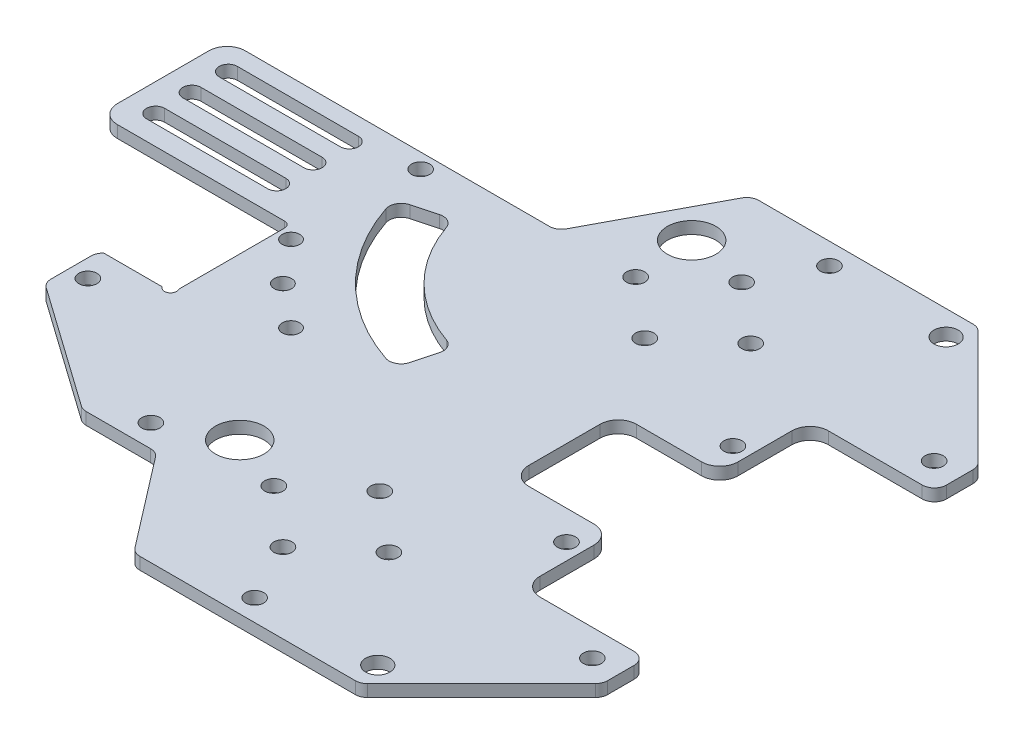
from build123d import *

# Parameters (mm, degrees)
SKETCH1_R           = 1.5
SKETCH1_R_2         = 2
SKETCH1_R_3         = 1.45
BOSS_EXTRUDE1_DEPTH = 2
CUT_EXTRUDE1_DEPTH  = 2
FILLET1_R           = 3
SKETCH3_R           = 1.5
CUT_EXTRUDE2_DEPTH  = 10
SKETCH_1_W          = 11.141106223
SKETCH_1_H          = 2.064068387
CUT_EXTRUDE_1_DEPTH = 10
SKETCH_2_R          = 4
CUT_EXTRUDE_2_DEPTH = 96.448488805
FILLET2_R           = 2
SKETCH4_R           = 1
CUT_EXTRUDE3_DEPTH  = 10
SKETCH5_W           = 11.82747082
SKETCH5_H           = 19.50302412
CUT_EXTRUDE4_DEPTH  = 10
FILLET3_R           = 1


with BuildPart() as part:
    # Sketch1 → Boss-Extrude1 (new body)
    with BuildSketch(Plane(origin=(0, 0, 0), x_dir=(1, 0, 0), z_dir=(0, 1, 0))):
        with BuildLine():
            Line((54.869224403, -12.305407816), (44.089868135, -12.305407816))
            ThreePointArc((44.089868135, -12.305407816), (41.968547791, -11.42672816), (41.089868135, -9.305407816))
            Line((41.089868135, -9.305407816), (41.089868135, 2.471948803))
            ThreePointArc((41.089868135, 2.471948803), (41.968547791, 4.593269147), (44.089868135, 5.471948803))
            Line((44.089868135, 5.471948803), (54.869224403, 5.471948803))
            ThreePointArc((54.869224403, 5.471948803), (56.990544747, 6.35062846), (57.869224403, 8.471948803))
            Line((57.869224403, 8.471948803), (57.869224403, 17.375765412))
            ThreePointArc((57.869224403, 17.375765412), (58.74790406, 19.497085755), (60.869224403, 20.375765412))
            Line((60.869224403, 20.375765412), (78.389804663, 20.375765412))
            Line((78.389804663, 20.375765412), (78.389804663, 27.585770494))
            Line((78.389804663, 27.585770494), (58.389804663, 47.585770494))
            Line((58.389804663, 47.585770494), (20.979804663, 47.585770494))
            Line((20.979804663, 47.585770494), (9.812981375, 26.583270494))
            Line((9.812981375, 26.583270494), (-13.868656246, 26.583270494))
            Line((-13.868656246, 26.583270494), (-44.620364758, 26.583270494))
            Line((-44.620364758, 26.583270494), (-44.620364758, 5.471948803))
            Line((-44.620364758, 5.471948803), (-13.868656246, 5.471948803))
            Line((-13.868656246, 5.471948803), (-13.868656246, -11.444658054))
            Line((-13.868656246, -11.444658054), (-25.009762469, -11.444658054))
            Line((-25.009762469, -11.444658054), (-25.009762469, -23.143538054))
            Line((-25.009762469, -23.143538054), (-3.796559034, -38.143538054))
            Line((-3.796559034, -38.143538054), (8.464513563, -38.143538054))
            Line((8.464513563, -38.143538054), (20.979804663, -54.419229506))
            Line((20.979804663, -54.419229506), (58.389804663, -54.419229506))
            Line((58.389804663, -54.419229506), (78.389804663, -34.419229506))
            Line((78.389804663, -34.419229506), (78.389804663, -27.209224425))
            Line((78.389804663, -27.209224425), (60.869224403, -27.209224425))
            ThreePointArc((60.869224403, -27.209224425), (58.74790406, -26.330544768), (57.869224403, -24.209224425))
            Line((57.869224403, -24.209224425), (57.869224403, -15.305407816))
            ThreePointArc((57.869224403, -15.305407816), (56.990544747, -13.184087473), (54.869224403, -12.305407816))
        make_face()
        with Locations(Location((32.479804663, -41.294229506, 0), (0, 0, 270))):
            Circle(SKETCH1_R, mode=Mode.SUBTRACT)
        with Locations(Location((41.979804663, -33.294229506, 0), (0, 0, 270))):
            Circle(SKETCH1_R, mode=Mode.SUBTRACT)
        with Locations(Location((32.479804663, -25.294229506, 0), (0, 0, 270))):
            Circle(SKETCH1_R, mode=Mode.SUBTRACT)
        with Locations(Location((22.979804663, -33.294229506, 0), (0, 0, 270))):
            Circle(SKETCH1_R, mode=Mode.SUBTRACT)
        with Locations(Location((-10.194098263, 24.120202053, 0), (0, 0, 270))):
            Circle(SKETCH1_R, mode=Mode.SUBTRACT)
        with Locations(Location((-22.049699545, -18.984613762, 0), (0, 0, 270))):
            Circle(SKETCH1_R, mode=Mode.SUBTRACT)
        with Locations(Location((3.798471154, -34.419229506, 0), (0, 0, 270))):
            Circle(SKETCH1_R, mode=Mode.SUBTRACT)
        with Locations(Location((57.193929966, -50.345885936, 0), (0, 0, 270))):
            Circle(SKETCH1_R_2, mode=Mode.SUBTRACT)
        with Locations(Location((55.174344354, -17.159547773, 0), (0, 0, 270))):
            Circle(SKETCH1_R, mode=Mode.SUBTRACT)
        with Locations(Location((55.174344354, 10.32608876, 0), (0, 0, 270))):
            Circle(SKETCH1_R, mode=Mode.SUBTRACT)
        with Locations(Location((-10.866471131, 3.389008325, 0), (0, 0, 270))):
            Circle(SKETCH1_R_3, mode=Mode.SUBTRACT)
        with Locations(Location((-5.208623843, -3.610189063, 0), (0, 0, 270))):
            Circle(SKETCH1_R_3, mode=Mode.SUBTRACT)
        with Locations(Location((1.790573544, -9.268036351, 0), (0, 0, 270))):
            Circle(SKETCH1_R_3, mode=Mode.SUBTRACT)
        with Locations(Location((57.193929966, 43.512426923, 0), (0, 0, 90))):
            Circle(SKETCH1_R_2, mode=Mode.SUBTRACT)
        with Locations(Location((22.979804663, 26.460770494, 0), (0, 0, 90))):
            Circle(SKETCH1_R, mode=Mode.SUBTRACT)
        with Locations(Location((32.479804663, 18.460770494, 0), (0, 0, 90))):
            Circle(SKETCH1_R, mode=Mode.SUBTRACT)
        with Locations(Location((41.979804663, 26.460770494, 0), (0, 0, 90))):
            Circle(SKETCH1_R, mode=Mode.SUBTRACT)
        with Locations(Location((32.479804663, 34.460770494, 0), (0, 0, 90))):
            Circle(SKETCH1_R, mode=Mode.SUBTRACT)
        with BuildLine():
            Line((16.558909908, -4.425834893), (17.596504785, -0.553478093))
            ThreePointArc((17.596504785, -0.553478093), (17.431334664, 0.901622726), (16.318958433, 1.854103006))
            ThreePointArc((16.318958433, 1.854103006), (6.440151022, 8.038585802), (0.255668225, 17.917393213))
            ThreePointArc((0.255668225, 17.917393213), (-0.696812054, 19.029769444), (-2.151912873, 19.194939566))
            Line((-2.151912873, 19.194939566), (-6.024269674, 18.157344688))
            ThreePointArc((-6.024269674, 18.157344688), (-7.269100914, 17.170851095), (-7.402354016, 15.588126218))
            ThreePointArc((-7.402354016, 15.588126218), (0.783296772, 2.381731553), (13.989691438, -5.803919235))
            ThreePointArc((13.989691438, -5.803919235), (15.572416314, -5.670666133), (16.558909908, -4.425834893))
        make_face(mode=Mode.SUBTRACT)
    extrude(amount=BOSS_EXTRUDE1_DEPTH)

    # Sketch2 → Cut-Extrude1 (cut)
    with BuildSketch(Plane.XZ):
        with BuildLine():
            Line((-40.041862968, -8.700189144), (-20.041862968, -8.700189144))
            ThreePointArc((-20.041862968, -8.700189144), (-18.541862968, -10.200189144), (-20.041862968, -11.700189144))
            Line((-20.041862968, -11.700189144), (-40.041862968, -11.700189144))
            ThreePointArc((-40.041862968, -11.700189144), (-41.541862968, -10.200189144), (-40.041862968, -8.700189144))
        make_face()
        with BuildLine():
            Line((-40.041862968, -17.700189144), (-20.041862968, -17.700189144))
            ThreePointArc((-20.041862968, -17.700189144), (-18.541862968, -16.200189144), (-20.041862968, -14.700189144))
            Line((-20.041862968, -14.700189144), (-40.041862968, -14.700189144))
            ThreePointArc((-40.041862968, -14.700189144), (-41.541862968, -16.200189144), (-40.041862968, -17.700189144))
        make_face()
        with BuildLine():
            Line((-40.041862968, -23.700189144), (-20.041862968, -23.700189144))
            ThreePointArc((-20.041862968, -23.700189144), (-18.541862968, -22.200189144), (-20.041862968, -20.700189144))
            Line((-20.041862968, -20.700189144), (-40.041862968, -20.700189144))
            ThreePointArc((-40.041862968, -20.700189144), (-41.541862968, -22.200189144), (-40.041862968, -23.700189144))
        make_face()
    extrude(amount=-CUT_EXTRUDE1_DEPTH, mode=Mode.SUBTRACT)

    # Fillet1
    fillet1_edges = [part.edges().sort_by_distance(p)[0] for p in [
        (-44.620364758, 1, -5.471948803),
        (-44.620364758, 1, -26.583270494),
    ]]
    fillet(fillet1_edges, radius=FILLET1_R)

    # Sketch3 → Cut-Extrude2 (cut)
    with BuildSketch(Plane.XZ):
        with Locations(Location((37.394868442, -44.049147495, 0), (0, 0, 270))):
            Circle(SKETCH3_R)
        with Locations(Location((37.394868442, 50.882606508, 0), (0, 0, 270))):
            Circle(SKETCH3_R)
        with Locations(Location((73.927423247, 31.637693078, 0), (0, 0, 270))):
            Circle(SKETCH3_R)
        with Locations(Location((73.927423247, -24.804234066, 0), (0, 0, 270))):
            Circle(SKETCH3_R)
    extrude(amount=-CUT_EXTRUDE2_DEPTH, mode=Mode.SUBTRACT)

    # 草图1 → 切除-拉伸1 (cut)
    with BuildSketch(Plane.XZ):
        with Locations((-19.439209358, 12.476692248)):
            Rectangle(SKETCH_1_W, SKETCH_1_H)
    extrude(amount=-CUT_EXTRUDE_1_DEPTH, mode=Mode.SUBTRACT)

    # 草图2 → 切除-拉伸2 (cut, through all)
    with BuildSketch(Plane.XZ):
        with Locations(Location((13.601488823, 29.543202895, 0), (0, 0, 270))):
            Circle(SKETCH_2_R)
        with Locations(Location((22.351612258, -36.336152346, 0), (0, 0, 270))):
            Circle(SKETCH_2_R)
    extrude(amount=-CUT_EXTRUDE_2_DEPTH, mode=Mode.SUBTRACT)

    # Fillet2
    fillet2_edges = [part.edges().sort_by_distance(p)[0] for p in [
        (-25.009762469, 1, 13.508726441),
        (58.389804663, 1, -47.585770494),
        (78.389804663, 1, -27.585770494),
        (78.389804663, 1, -20.375765412),
        (78.389804663, 1, 27.209224425),
        (78.389804663, 1, 34.419229506),
        (58.389804663, 1, 54.419229506),
        (20.979804663, 1, 54.419229506),
        (8.464513563, 1, 38.143538054),
        (-3.796559034, 1, 38.143538054),
        (-25.009762469, 1, 23.143538054),
        (-13.868656246, 1, -5.471948803),
        (9.812981375, 1, -26.583270494),
        (20.979804663, 1, -47.585770494),
    ]]
    fillet(fillet2_edges, radius=FILLET2_R)

    # Sketch4 → Cut-Extrude3 (cut)
    with BuildSketch(Plane(origin=(0, 2, 0), x_dir=(1, 0, 0), z_dir=(0, 1, 0))):
        with Locations((-13.868656246, -13.508726441)):
            Circle(SKETCH4_R)
    extrude(amount=-CUT_EXTRUDE3_DEPTH, mode=Mode.SUBTRACT)

    # Sketch5 → Cut-Extrude4 (cut)
    with BuildSketch(Plane(origin=(0, 2, 0), x_dir=(1, 0, 0), z_dir=(0, 1, 0))):
        with Locations((-18.928899697, -4.279563257)):
            Rectangle(SKETCH5_W, SKETCH5_H)
    extrude(amount=-CUT_EXTRUDE4_DEPTH, mode=Mode.SUBTRACT)

    # Fillet3
    fillet3_edges = [part.edges().sort_by_distance(p)[0] for p in [
        (-13.015164287, 1, -5.471948803),
    ]]
    fillet(fillet3_edges, radius=FILLET3_R)


solid = part.part
